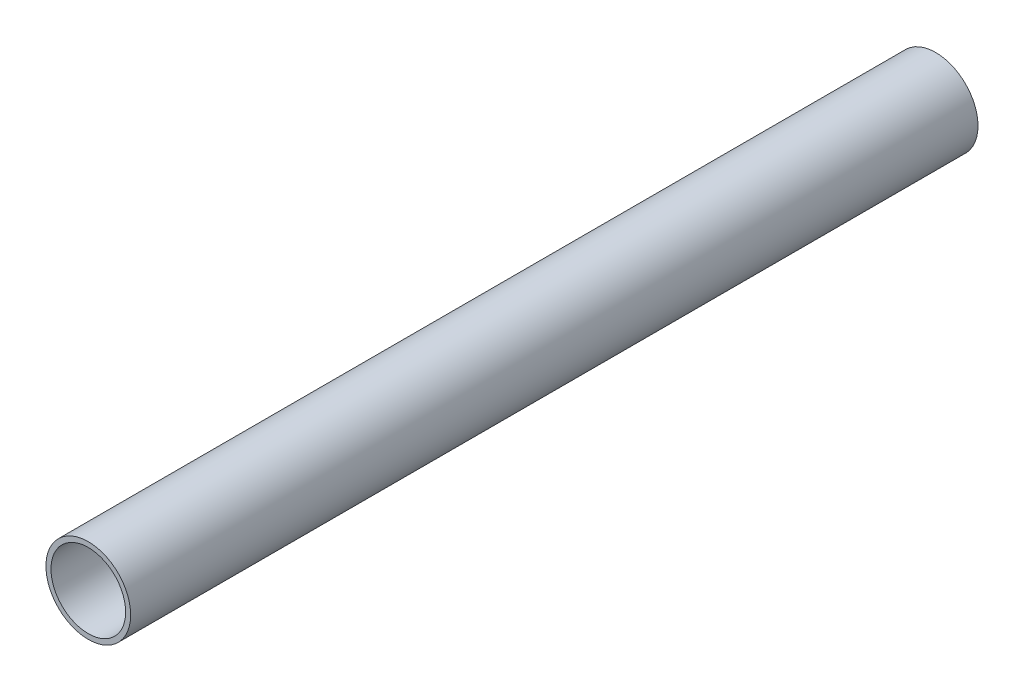
from build123d import *

# Parameters (mm, degrees)
PIPESKETCH_R    = 16
PIPESKETCH_R_2  = 14.1
EXTRUSION_DEPTH = 320


with BuildPart() as part:
    # PipeSketch → Extrusion (new body)
    with BuildSketch(Plane.XY):
        Circle(PIPESKETCH_R)
        Circle(PIPESKETCH_R_2, mode=Mode.SUBTRACT)
    extrude(amount=EXTRUSION_DEPTH)


solid = part.part
